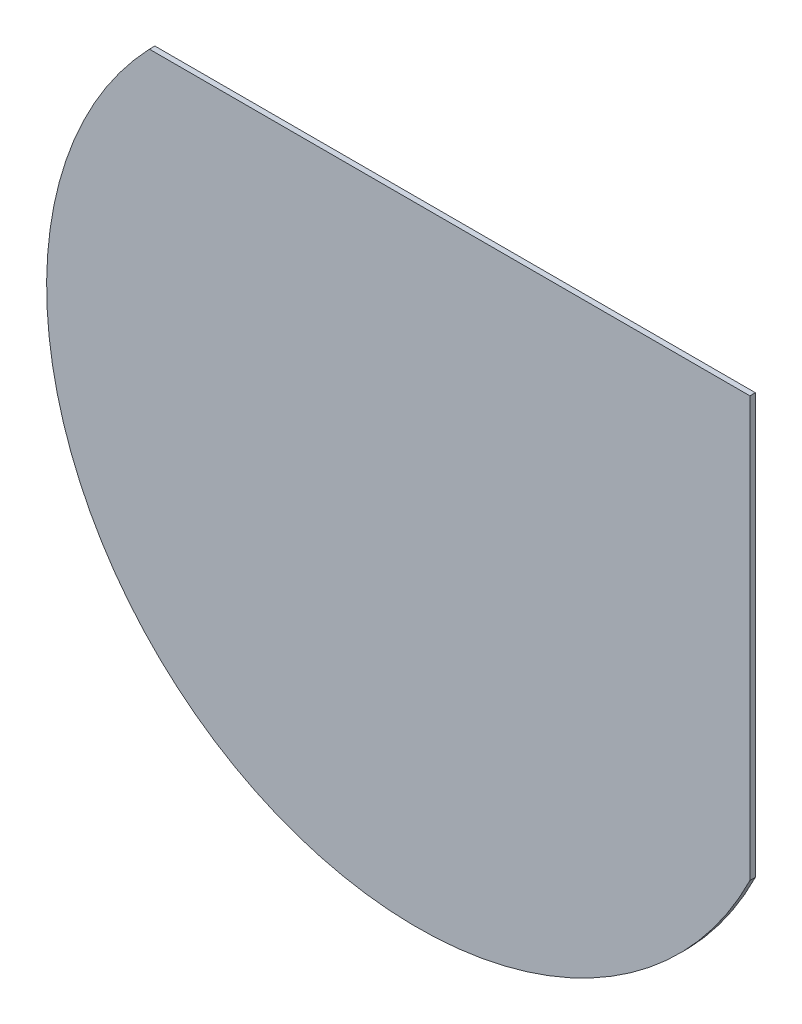
from build123d import *

# Parameters (mm, degrees)
BOSS_EXTRUDE1_DEPTH = 1


with BuildPart() as part:
    # Sketch1 → Boss-Extrude1 (new body)
    with BuildSketch(Plane.XY):
        with BuildLine():
            Line((61.02458521, 47), (61.02458521, -30))
            ThreePointArc((61.02458521, -30), (-38.955681217, -55.735580207), (-49.142649501, 47))
            Line((-49.142649501, 47), (61.02458521, 47))
        make_face()
    extrude(amount=-BOSS_EXTRUDE1_DEPTH)


solid = part.part
